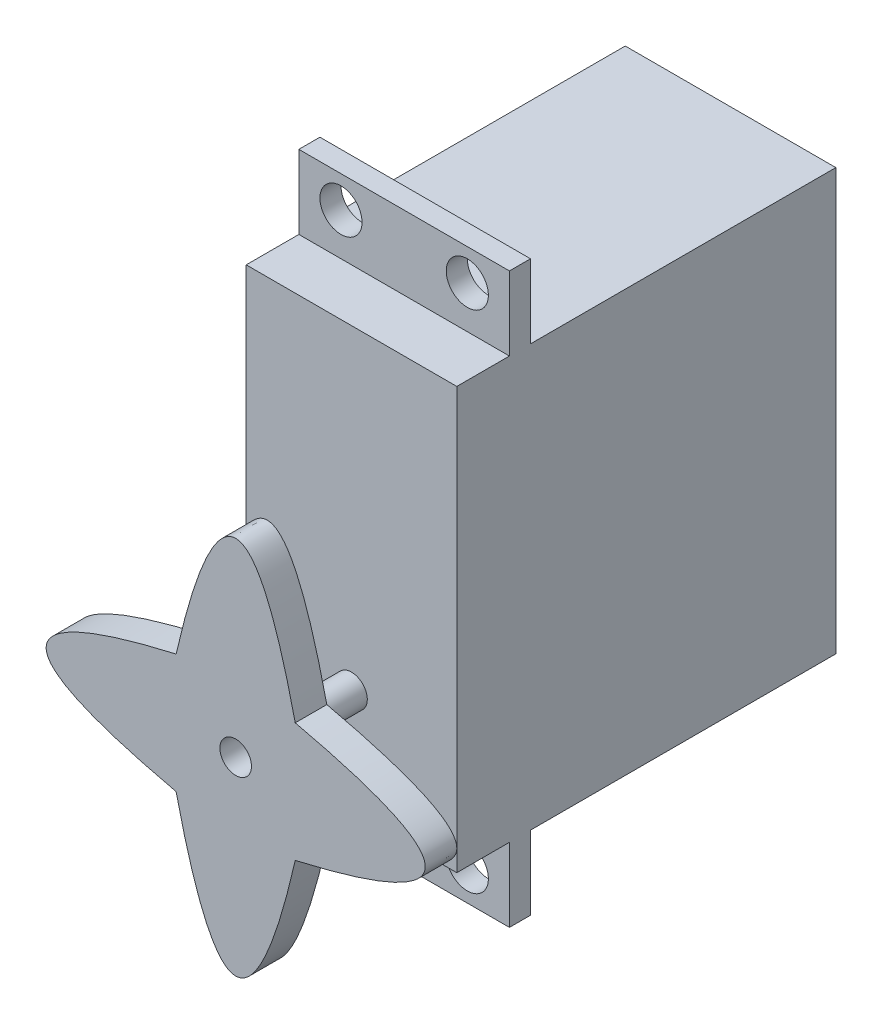
from build123d import *

# Parameters (mm, degrees)
SKETCH_1_W           = 20
SKETCH_1_H           = 40
EXTRUDE_1_DEPTH      = 36
EXTRUDE_2_DEPTH      = 7
EXTRUDE_2_DEPTH_BACK = 47
SKETCH_2_W           = 20
SKETCH_2_H           = 2
CUT_EXTRUDE_1_REACH  = 61.749
SKETCH_3_R           = 2
SKETCH_4_R           = 1.5
EXTRUDE_3_DEPTH      = 8
EXTRUDE_4_DEPTH      = 3


with BuildPart() as part:
    # 草图1 → 凸台-拉伸1 (new body)
    with BuildSketch(Plane.XY):
        with Locations((10, 20)):
            Rectangle(SKETCH_1_W, SKETCH_1_H)
    extrude(amount=EXTRUDE_1_DEPTH)

    # 草图2 → 凸台-拉伸2 (add, two sides: drawn at the far end of the back side and taken through both)
    with BuildSketch(Plane.XZ.offset(-EXTRUDE_2_DEPTH_BACK)):
        with Locations((10, 30)):
            Rectangle(SKETCH_2_W, SKETCH_2_H)
    extrude(amount=EXTRUDE_2_DEPTH + EXTRUDE_2_DEPTH_BACK)

    # 草图3 → 切除-拉伸1 (cut, up to next)
    with BuildSketch(Plane.XY.offset(31), mode=Mode.PRIVATE) as cut_extrude_1_sk1:
        with Locations((4, -4)):
            Circle(SKETCH_3_R)
    cut_extrude_1_tool1 = extrude(cut_extrude_1_sk1.sketch, amount=-CUT_EXTRUDE_1_REACH, mode=Mode.PRIVATE) & part.part
    # 草图3 → 切除-拉伸1 (cut, up to next)
    with BuildSketch(Plane.XY.offset(31), mode=Mode.PRIVATE) as cut_extrude_1_sk2:
        with Locations((16, -4)):
            Circle(SKETCH_3_R)
    cut_extrude_1_tool2 = extrude(cut_extrude_1_sk2.sketch, amount=-CUT_EXTRUDE_1_REACH, mode=Mode.PRIVATE) & part.part
    # 草图3 → 切除-拉伸1 (cut, up to next)
    with BuildSketch(Plane.XY.offset(31), mode=Mode.PRIVATE) as cut_extrude_1_sk3:
        with Locations((4, 44)):
            Circle(SKETCH_3_R)
    cut_extrude_1_tool3 = extrude(cut_extrude_1_sk3.sketch, amount=-CUT_EXTRUDE_1_REACH, mode=Mode.PRIVATE) & part.part
    # 草图3 → 切除-拉伸1 (cut, up to next)
    with BuildSketch(Plane.XY.offset(31), mode=Mode.PRIVATE) as cut_extrude_1_sk4:
        with Locations((16, 44)):
            Circle(SKETCH_3_R)
    cut_extrude_1_tool4 = extrude(cut_extrude_1_sk4.sketch, amount=-CUT_EXTRUDE_1_REACH, mode=Mode.PRIVATE) & part.part
    add(cut_extrude_1_tool1.solids().sort_by_distance((4, -4, 31))[0], mode=Mode.SUBTRACT)
    add(cut_extrude_1_tool2.solids().sort_by_distance((16, -4, 31))[0], mode=Mode.SUBTRACT)
    add(cut_extrude_1_tool3.solids().sort_by_distance((4, 44, 31))[0], mode=Mode.SUBTRACT)
    add(cut_extrude_1_tool4.solids().sort_by_distance((16, 44, 31))[0], mode=Mode.SUBTRACT)

    # 草图4 → 凸台-拉伸3 (add)
    with BuildSketch(Plane.XY.offset(36)):
        with Locations(Location((10, 10, 0), (0, 0, 180))):
            Circle(SKETCH_4_R)
    extrude(amount=EXTRUDE_3_DEPTH)


with BuildPart() as body_2:
    # 草图5 → 凸台-拉伸4 (new body)
    with BuildSketch(Plane.XY.offset(44)):
        with BuildLine():
            add(Edge.make_bspline(
                [(10, -8), (12.828427125, -8), (15.656854249, 4.343145751)],
                knots=[0.5, 0.5, 0.5, 1, 1, 1], degree=2))
            ThreePointArc((15.656854249, 4.343145751), (13.061467459, 2.60896374), (10, 2))
            Line((10, 2), (10, -8))
        make_face()
        with BuildLine():
            Line((10, -8), (10, 2))
            ThreePointArc((10, 2), (6.938532541, 2.60896374), (4.343145751, 4.343145751))
            add(Edge.make_bspline(
                [(4.343145751, 4.343145751), (7.171572875, -8), (10, -8)],
                knots=[0, 0, 0, 0.5, 0.5, 0.5], degree=2))
        make_face()
        with BuildLine():
            Line((18, 10), (11.5, 10))
            ThreePointArc((11.5, 10), (11.385819299, 9.425974851), (11.060660172, 8.939339828))
            Line((11.060660172, 8.939339828), (15.656854249, 4.343145751))
            ThreePointArc((15.656854249, 4.343145751), (17.39103626, 6.938532541), (18, 10))
        make_face()
        with BuildLine():
            add(Edge.make_bspline(
                [(28, 10), (28, 12.828427125), (15.656854249, 15.656854249)],
                knots=[0.5, 0.5, 0.5, 1, 1, 1], degree=2))
            ThreePointArc((15.656854249, 15.656854249), (17.39103626, 13.061467459), (18, 10))
            Line((18, 10), (28, 10))
        make_face()
        with BuildLine():
            Line((28, 10), (18, 10))
            ThreePointArc((18, 10), (17.39103626, 6.938532541), (15.656854249, 4.343145751))
            add(Edge.make_bspline(
                [(15.656854249, 4.343145751), (28, 7.171572875), (28, 10)],
                knots=[0, 0, 0, 0.5, 0.5, 0.5], degree=2))
        make_face()
        with BuildLine():
            Line((15.656854249, 15.656854249), (11.060660172, 11.060660172))
            ThreePointArc((11.060660172, 11.060660172), (11.385819299, 10.574025149), (11.5, 10))
            Line((11.5, 10), (18, 10))
            ThreePointArc((18, 10), (17.39103626, 13.061467459), (15.656854249, 15.656854249))
        make_face()
        with BuildLine():
            Line((10, 18), (10, 11.5))
            ThreePointArc((10, 11.5), (10.574025149, 11.385819299), (11.060660172, 11.060660172))
            Line((11.060660172, 11.060660172), (15.656854249, 15.656854249))
            ThreePointArc((15.656854249, 15.656854249), (13.061467459, 17.39103626), (10, 18))
        make_face()
        with BuildLine():
            add(Edge.make_bspline(
                [(4.343145751, 15.656854249), (7.171572875, 28), (10, 28)],
                knots=[0, 0, 0, 0.5, 0.5, 0.5], degree=2))
            ThreePointArc((4.343145751, 15.656854249), (6.938532541, 17.39103626), (10, 18))
            Line((10, 18), (10, 28))
        make_face()
        with BuildLine():
            Line((10, 28), (10, 18))
            ThreePointArc((10, 18), (13.061467459, 17.39103626), (15.656854249, 15.656854249))
            add(Edge.make_bspline(
                [(10, 28), (12.828427125, 28), (15.656854249, 15.656854249)],
                knots=[0.5, 0.5, 0.5, 1, 1, 1], degree=2))
        make_face()
        with BuildLine():
            Line((4.343145751, 15.656854249), (8.939339828, 11.060660172))
            ThreePointArc((8.939339828, 11.060660172), (9.425974851, 11.385819299), (10, 11.5))
            Line((10, 11.5), (10, 18))
            ThreePointArc((10, 18), (6.938532541, 17.39103626), (4.343145751, 15.656854249))
        make_face()
        with BuildLine():
            Line((2, 10), (8.5, 10))
            ThreePointArc((8.5, 10), (8.614180701, 10.574025149), (8.939339828, 11.060660172))
            Line((8.939339828, 11.060660172), (4.343145751, 15.656854249))
            ThreePointArc((4.343145751, 15.656854249), (2.60896374, 13.061467459), (2, 10))
        make_face()
        with BuildLine():
            ThreePointArc((4.343145751, 4.343145751), (2.60896374, 6.938532541), (2, 10))
            Line((2, 10), (-8, 10))
            add(Edge.make_bspline(
                [(4.343145751, 4.343145751), (-8, 7.171572875), (-8, 10)],
                knots=[0, 0, 0, 0.5, 0.5, 0.5], degree=2))
        make_face()
        with BuildLine():
            Line((-8, 10), (2, 10))
            ThreePointArc((2, 10), (2.60896374, 13.061467459), (4.343145751, 15.656854249))
            add(Edge.make_bspline(
                [(-8, 10), (-8, 12.828427125), (4.343145751, 15.656854249)],
                knots=[0.5, 0.5, 0.5, 1, 1, 1], degree=2))
        make_face()
        with BuildLine():
            ThreePointArc((8.939339828, 8.939339828), (8.614180701, 9.425974851), (8.5, 10))
            Line((8.5, 10), (2, 10))
            ThreePointArc((2, 10), (2.60896374, 6.938532541), (4.343145751, 4.343145751))
            Line((4.343145751, 4.343145751), (8.939339828, 8.939339828))
        make_face()
        with BuildLine():
            Line((10, 2), (10, 8.5))
            ThreePointArc((10, 8.5), (9.425974851, 8.614180701), (8.939339828, 8.939339828))
            Line((8.939339828, 8.939339828), (4.343145751, 4.343145751))
            ThreePointArc((4.343145751, 4.343145751), (6.938532541, 2.60896374), (10, 2))
        make_face()
        with BuildLine():
            Line((15.656854249, 4.343145751), (11.060660172, 8.939339828))
            ThreePointArc((11.060660172, 8.939339828), (10.574025149, 8.614180701), (10, 8.5))
            Line((10, 8.5), (10, 2))
            ThreePointArc((10, 2), (13.061467459, 2.60896374), (15.656854249, 4.343145751))
        make_face()
    extrude(amount=EXTRUDE_4_DEPTH)


solid = Compound([part.part, body_2.part])
